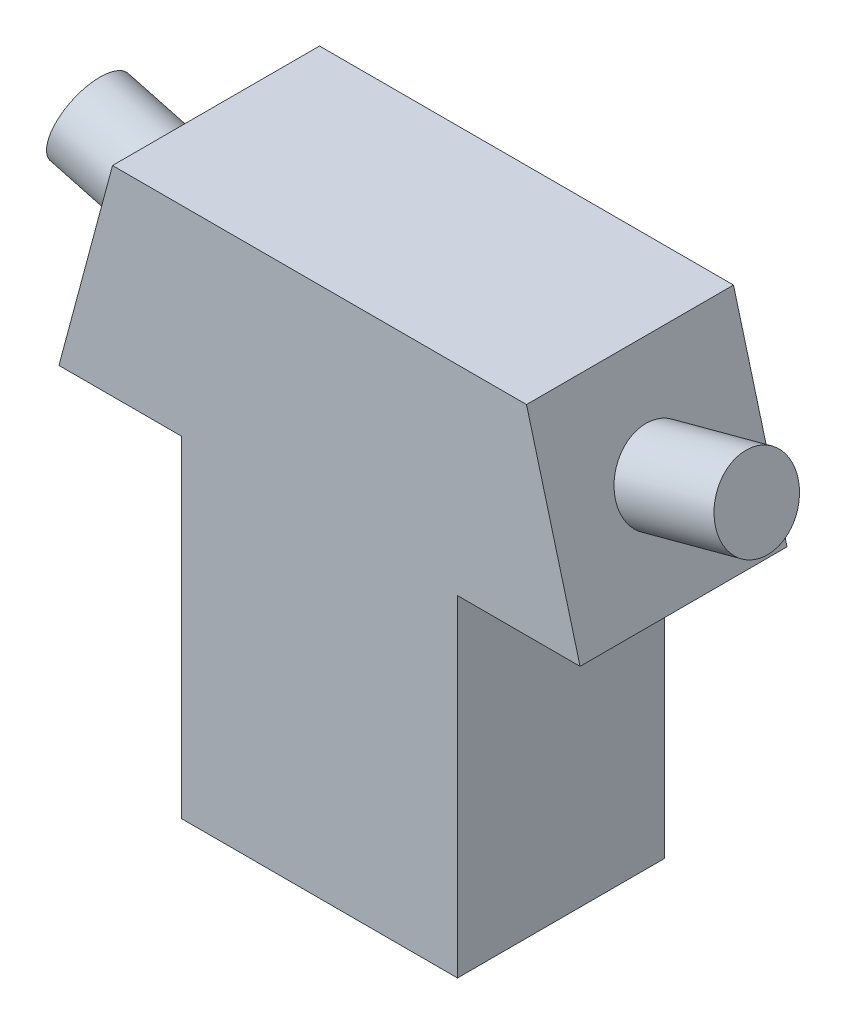
from build123d import *

# Parameters (mm, degrees)
EXTRUDE_1_DEPTH     = 150
SKETCH_3_R          = 30
EXTRUDE_2_DEPTH     = 75
SKETCH_4_R          = 50
CUT_EXTRUDE_1_DEPTH = 100


with BuildPart() as part:
    # 草图1 → 凸台-拉伸1 (new body)
    with BuildSketch(Plane.XY):
        Polygon((-100, 0), (100, 0), (100, 240), (188.822856765, 240), (150, 384.888873943), (-150, 384.888873943), (-188.822856765, 240), (-100, 240), align=None)
    extrude(amount=EXTRUDE_1_DEPTH)

    # 草图3 → 凸台-拉伸2 (add)
    with BuildSketch(Plane(origin=(236.17412377, 63.282665737, 0), x_dir=(0, 0, -1), z_dir=(0.9659258262890672, 0.2588190451025252, 0))):
        with Locations(Location((-75, 257.951246828, 0), (0, 0, 90))):
            Circle(SKETCH_3_R)
    extrude_2 = extrude(amount=EXTRUDE_2_DEPTH)

    # 镜向1: 凸台-拉伸2 across plane
    add(extrude_2.mirror(Plane.ZY))

    # 草图4 → 切除-拉伸1 (cut)
    with BuildSketch(Plane.XZ):
        with Locations(Location((0, 75, 0), (0, 0, 270))):
            Circle(SKETCH_4_R)
    extrude(amount=-CUT_EXTRUDE_1_DEPTH, mode=Mode.SUBTRACT)


solid = part.part
